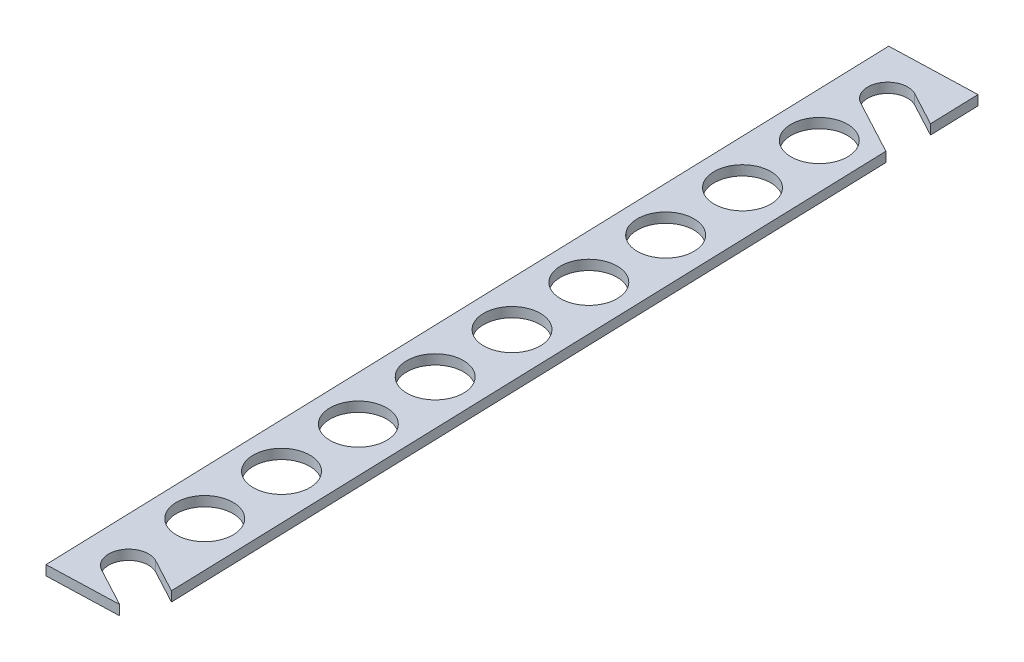
from build123d import *

# Parameters (mm, degrees)
SKETCH1_R           = 4.572
BOSS_EXTRUDE1_DEPTH = 1.5875


with BuildPart() as part:
    # Sketch1 → Boss-Extrude1 (new body)
    with BuildSketch(Plane(origin=(0, 0, 0), x_dir=(1, 0, 0), z_dir=(0, 1, 0))):
        with BuildLine():
            Line((6.776434369, -70.199185368), (-4.764680988, -70.565352679))
            Line((-4.764680988, -70.565352679), (-9.22827802, 70.121395226))
            Line((-9.22827802, 70.121395226), (4.764680988, 70.565352679))
            Line((4.764680988, 70.565352679), (5.016361067, 62.63272534))
            Line((5.016361067, 62.63272534), (-0.466659313, 65.570573089))
            ThreePointArc((-0.466659313, 65.570573089), (-4.833525642, 64.250705768), (-3.51365832, 59.883839439))
            Line((-3.51365832, 59.883839439), (5.252599263, 55.186805992))
            Line((5.252599263, 55.186805992), (9.036951983, -64.09104847))
            Line((9.036951983, -64.09104847), (3.553931604, -61.153200721))
            ThreePointArc((3.553931604, -61.153200721), (-0.812934725, -62.473068042), (0.506932596, -66.839934371))
            Line((0.506932596, -66.839934371), (6.776434369, -70.199185368))
        make_face()
        with Locations(Location((-1.627699267, 51.302954732, 0), (0, 0, 270))):
            Circle(SKETCH1_R, mode=Mode.SUBTRACT)
        with Locations(Location((-1.22077445, 38.477216049, 0), (0, 0, 270))):
            Circle(SKETCH1_R, mode=Mode.SUBTRACT)
        with Locations(Location((-0.813849634, 25.651477366, 0), (0, 0, 270))):
            Circle(SKETCH1_R, mode=Mode.SUBTRACT)
        with Locations(Location((-0.406924817, 12.825738683, 0), (0, 0, 270))):
            Circle(SKETCH1_R, mode=Mode.SUBTRACT)
        with Locations(Location((0, 0, 0), (0, 0, 270))):
            Circle(SKETCH1_R, mode=Mode.SUBTRACT)
        with Locations(Location((0.406924817, -12.825738683, 0), (0, 0, 270))):
            Circle(SKETCH1_R, mode=Mode.SUBTRACT)
        with Locations(Location((0.813849634, -25.651477366, 0), (0, 0, 270))):
            Circle(SKETCH1_R, mode=Mode.SUBTRACT)
        with Locations(Location((1.22077445, -38.477216049, 0), (0, 0, 270))):
            Circle(SKETCH1_R, mode=Mode.SUBTRACT)
        with Locations(Location((1.627699267, -51.302954732, 0), (0, 0, 270))):
            Circle(SKETCH1_R, mode=Mode.SUBTRACT)
    extrude(amount=BOSS_EXTRUDE1_DEPTH)


solid = part.part
